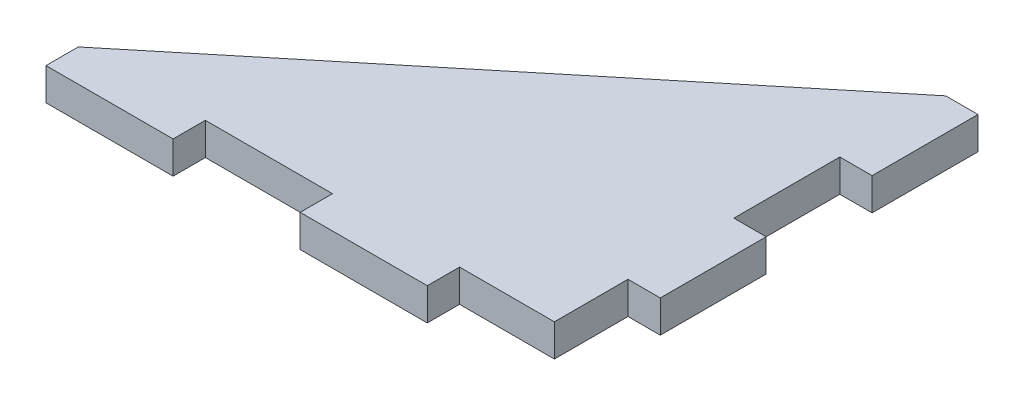
from build123d import *

# Parameters (mm, degrees)
BOSS_EXTRUDE1_DEPTH = 6.096


with BuildPart() as part:
    # Sketch1 → Boss-Extrude1 (new body)
    with BuildSketch(Plane(origin=(0, 0, 0), x_dir=(1, 0, 0), z_dir=(0, 1, 0))):
        Polygon((0, 0), (24, 0), (24, 6.096), (48, 6.096), (48, 0), (72, 0), (72, 6.096), (89.904, 6.096), (89.904, 20), (96, 20), (96, 40), (89.904, 40), (89.904, 60), (96, 60), (96, 80), (89.904, 80), (0, 6.096), align=None)
    extrude(amount=BOSS_EXTRUDE1_DEPTH)


solid = part.part
